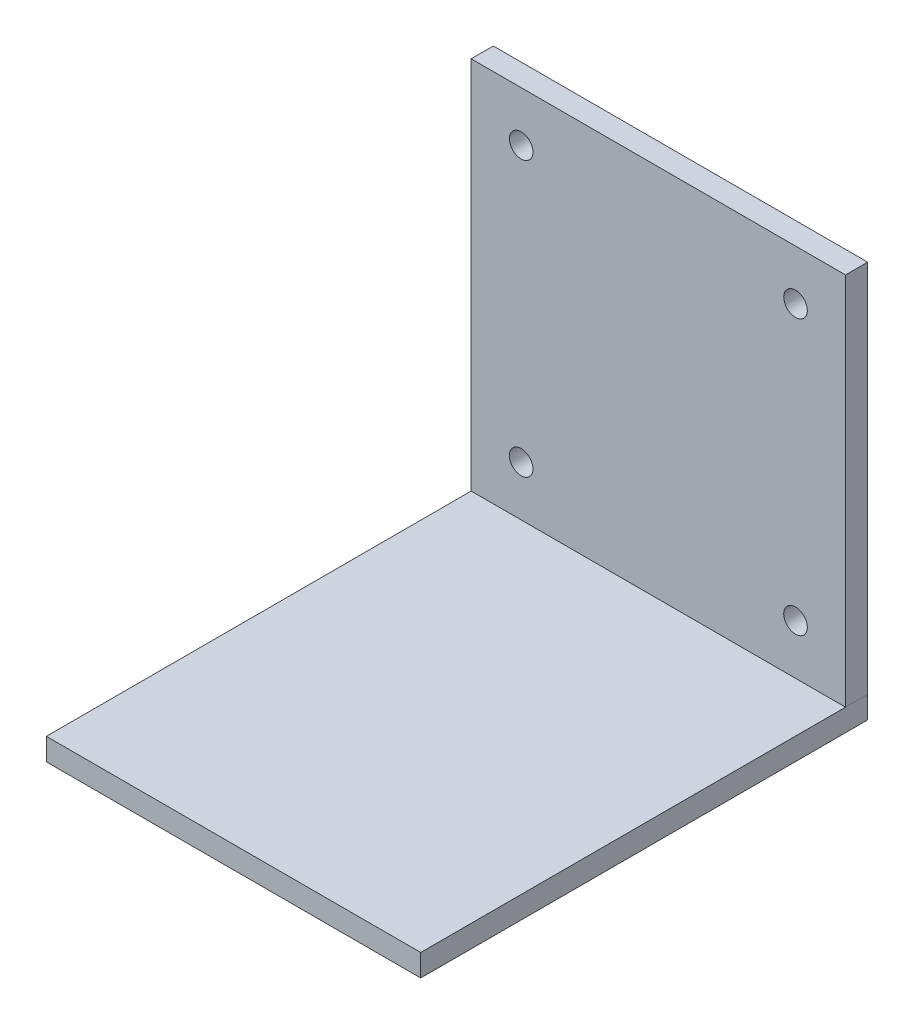
from build123d import *

# Parameters (mm, degrees)
SKETCH2_W           = 42.3
SKETCH2_H           = 42.3
SKETCH2_R           = 1.3335
BOSS_EXTRUDE1_DEPTH = 2.5
BOSS_EXTRUDE2_DEPTH = 2.5


with BuildPart() as part:
    # Sketch2 → Boss-Extrude1 (new body)
    with BuildSketch(Plane.XY):
        Rectangle(SKETCH2_W, SKETCH2_H)
        with Locations((-15.5, 15.5)):
            Circle(SKETCH2_R, mode=Mode.SUBTRACT)
        with Locations(Location((15.5, 15.5, 0), (0, 0, 180))):
            Circle(SKETCH2_R, mode=Mode.SUBTRACT)
        with Locations((15.5, -15.5)):
            Circle(SKETCH2_R, mode=Mode.SUBTRACT)
        with Locations(Location((-15.5, -15.5, 0), (0, 0, 180))):
            Circle(SKETCH2_R, mode=Mode.SUBTRACT)
    extrude(amount=BOSS_EXTRUDE1_DEPTH)


with BuildPart() as body_2:
    # Sketch3 → Boss-Extrude2 (new body)
    with BuildSketch(Plane.XZ.offset(21.15)):
        Polygon((21.15, 2.5), (21.15, 50.5), (-21.15, 50.5), (-21.15, 2.5), (-21.15, 0), (21.15, 0), align=None)
    extrude(amount=BOSS_EXTRUDE2_DEPTH)


solid = Compound([part.part, body_2.part])
